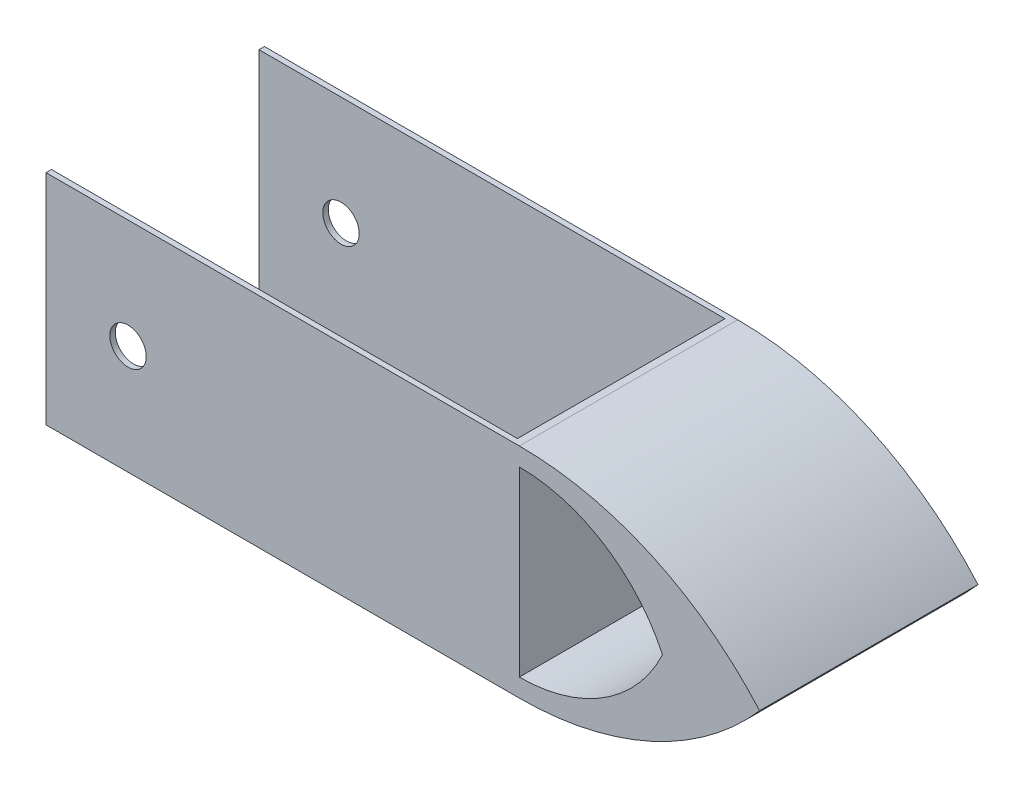
from build123d import *

# Parameters (mm, degrees)
RESSALTO_EXTRUS_O1_DEPTH   = 60
CORTE_EXTRUS_O1_DEPTH      = 148.170653102
CORTE_EXTRUS_O1_DEPTH_BACK = 148.170653102
CORTE_EXTRUS_O2_DEPTH      = 148.170653102
CORTE_EXTRUS_O2_DEPTH_BACK = 148.170653102
ESBO_O5_W                  = 126
ESBO_O5_H                  = 57
ESBO_O6_W                  = 57
ESBO_O6_H                  = 60
CORTE_EXTRUS_O3_DEPTH      = 57
CORTE_EXTRUS_O4_DEPTH      = 148.170653102
CORTE_EXTRUS_O4_DEPTH_BACK = 57
ESBO_O7_R                  = 5


with BuildPart() as part:
    # Esboço1 → Ressalto-extrusão1 (new body)
    with BuildSketch(Plane.XY):
        with BuildLine():
            Line((65, 30), (-65, 30))
            Line((-65, 30), (-65, -30))
            Line((-65, -30), (65, -30))
            ThreePointArc((65, -30), (101.246012625, -22.148036763), (130.993133921, 0))
            ThreePointArc((130.993133921, 0), (101.246012625, 22.148036763), (65, 30))
        make_face()
    extrude(amount=RESSALTO_EXTRUS_O1_DEPTH)

    # Esboço3 → Corte-extrusão1 (cut, two sides: drawn at the far end of the back side and taken through both)
    with BuildSketch(Plane.XY.offset(-CORTE_EXTRUS_O1_DEPTH_BACK)):
        with BuildLine():
            Line((65, 25), (65, -25))
            ThreePointArc((65, -25), (88.305470739, -18.221231084), (104.339291624, 0))
            ThreePointArc((104.339291624, 0), (88.305470739, 18.221231084), (65, 25))
        make_face()
    extrude(amount=CORTE_EXTRUS_O1_DEPTH + CORTE_EXTRUS_O1_DEPTH_BACK, mode=Mode.SUBTRACT)

    # Esboço5 → Corte-extrusão2 (cut, two sides: drawn at the far end of the back side and taken through both)
    with BuildSketch(Plane(origin=(0, 0, 0), x_dir=(1, 0, 0), z_dir=(0, 1, 0)).offset(-CORTE_EXTRUS_O2_DEPTH_BACK)):
        with Locations((0, -30)):
            Rectangle(ESBO_O5_W, ESBO_O5_H)
    extrude(amount=CORTE_EXTRUS_O2_DEPTH + CORTE_EXTRUS_O2_DEPTH_BACK, mode=Mode.SUBTRACT)

    # Esboço6 → Corte-extrusão3 (cut)
    with BuildSketch(Plane(origin=(-63, 0, 0), x_dir=(0, 0, -1), z_dir=(1, 0, 0))):
        with Locations((-30, 0)):
            Rectangle(ESBO_O6_W, ESBO_O6_H)
    extrude(amount=-CORTE_EXTRUS_O3_DEPTH, mode=Mode.SUBTRACT)

    # Esboço7 → Corte-extrusão4 (cut, two sides: drawn at the far end of the back side and taken through both)
    with BuildSketch(Plane.XY.offset(-CORTE_EXTRUS_O4_DEPTH_BACK)):
        with Locations((-42.467037106, 0)):
            Circle(ESBO_O7_R)
    extrude(amount=CORTE_EXTRUS_O4_DEPTH + CORTE_EXTRUS_O4_DEPTH_BACK, mode=Mode.SUBTRACT)


solid = part.part
